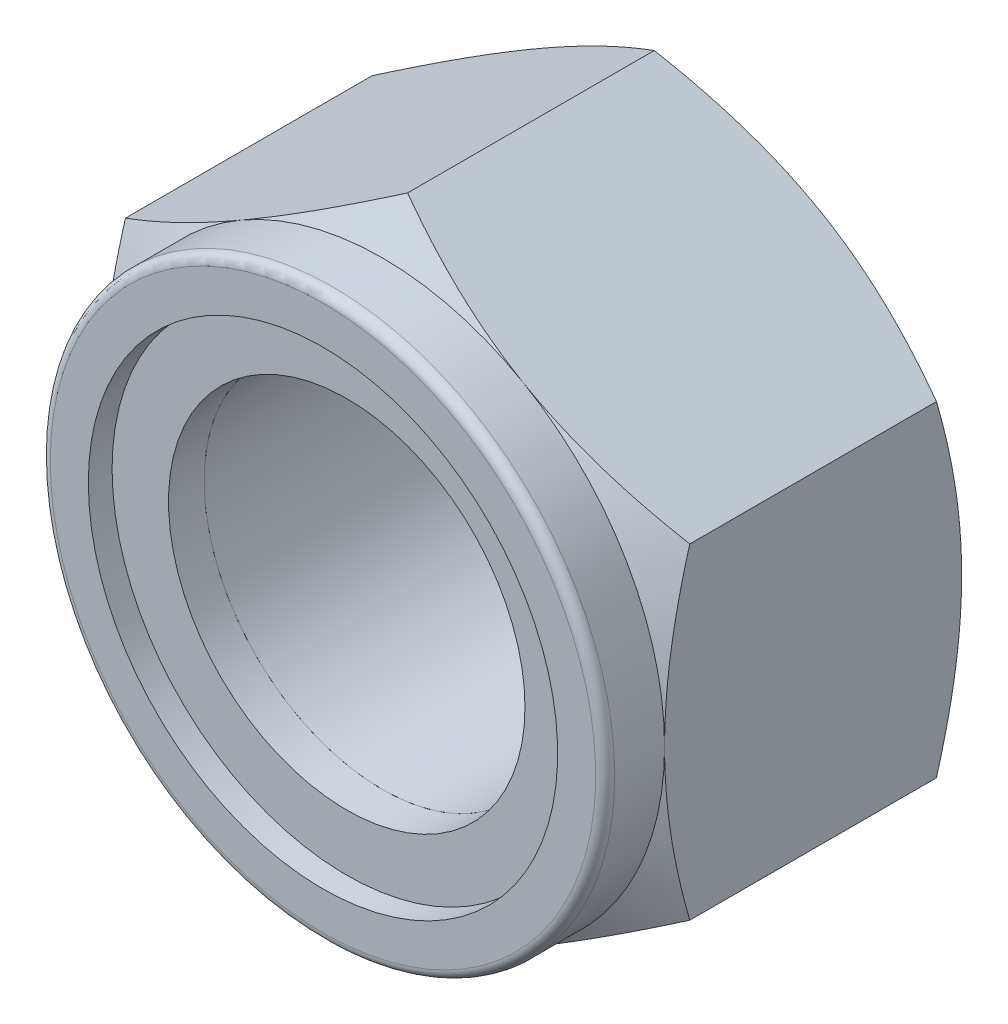
from build123d import *

# Parameters (mm, degrees)
EXTRUDE1_DEPTH     = 10
SKETCH5_R          = 8.7
SKETCH5_R_2        = 6
EXTRUDE2_DEPTH     = 1.2
SKETCH4_R          = 6
CUT_EXTRUDE1_DEPTH = 19.83038325
FILLET2_R          = 0.32


with BuildPart() as part:
    # Sketch1 → Extrude1 (new body)
    with BuildSketch(Plane.XY):
        Polygon((0, 10.969655115), (-9.5, 5.484827557), (-9.5, -5.484827557), (0, -10.969655115), (9.5, -5.484827557), (9.5, 5.484827557), align=None)
    extrude(amount=EXTRUDE1_DEPTH)

    # Sketch2 → Cut-Revolve1 (revolve, cut)
    with BuildSketch(Plane(origin=(0, 0, 0), x_dir=(1, 0, 0), z_dir=(0, 1, 0))):
        Polygon((9.5, -10), (13.3, -10), (13.3, -7.806068977), align=None)
    cut_revolve1 = revolve(axis=Axis((0, 0, 0), (0, 0, 1)), mode=Mode.SUBTRACT)

    # Mirror1: Cut-Revolve1 across plane
    add(cut_revolve1.mirror(Plane(origin=(0, 0, 5), x_dir=(1, 0, 0), z_dir=(0, 0, -1))), mode=Mode.SUBTRACT)

    # Sketch3 → Revolve1 (revolve)
    with BuildSketch(Plane(origin=(0, 0, 0), x_dir=(1, 0, 0), z_dir=(0, 1, 0)), mode=Mode.PRIVATE) as revolve1_sk:
        Polygon((9.5, -10), (9.5, -12), (7.9, -12), (7.9, -11.2), (8.7, -11.2), (8.7, -10), align=None)
    revolve(revolve1_sk.sketch.rotate(Axis((0, 0, 0), (0, 0, 1)), 180), axis=Axis((0, 0, 0), (0, 0, 1)))

    # Sketch4 → Cut-Extrude1 (cut, through all)
    with BuildSketch(Plane(origin=(0, 0, 0), x_dir=(-1, 0, 0), z_dir=(0, 0, -1))):
        with Locations(Location((0, 0, 0), (0, 0, 180))):
            Circle(SKETCH4_R)
    extrude(amount=-CUT_EXTRUDE1_DEPTH, mode=Mode.SUBTRACT)

    # Fillet2
    fillet2_edges = [part.edges().sort_by_distance(p)[0] for p in [
        (9.5, 0, 12),
    ]]
    fillet(fillet2_edges, radius=FILLET2_R)


with BuildPart() as body_2:
    # Sketch5 → Extrude2 (new body)
    with BuildSketch(Plane.XY.offset(10)):
        Circle(SKETCH5_R)
        Circle(SKETCH5_R_2, mode=Mode.SUBTRACT)
    extrude(amount=EXTRUDE2_DEPTH)


solid = Compound([part.part, body_2.part])
